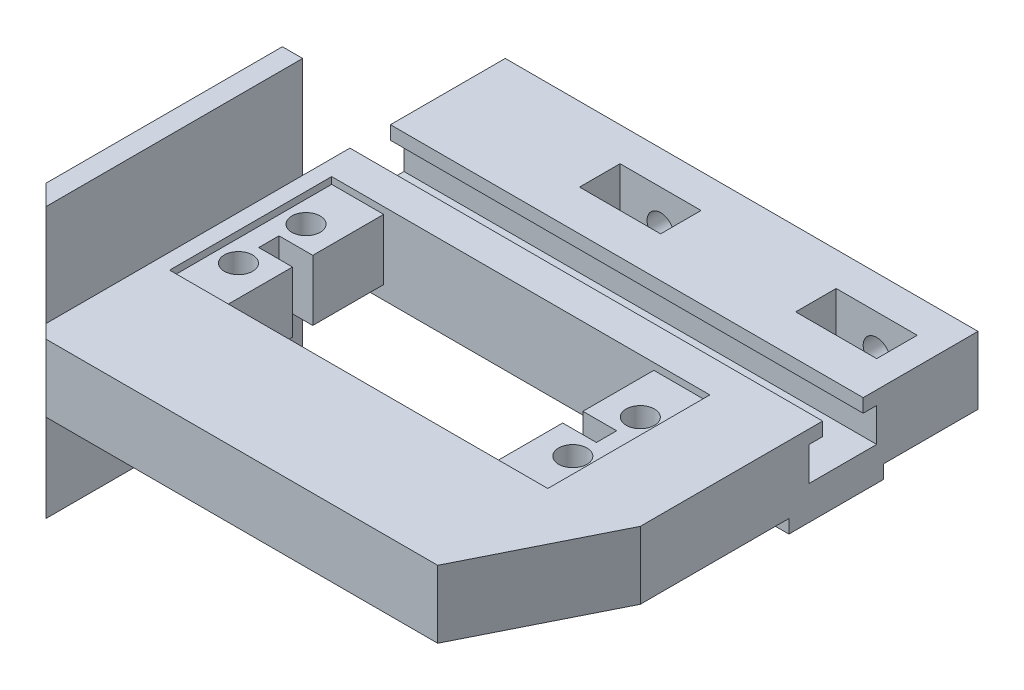
from build123d import *

# Parameters (mm, degrees)
SKETCH_1_W           = 80
SKETCH_1_H           = 60
SKETCH_1_R           = 2.1
SKETCH_1_W_2         = 40
SKETCH_1_H_2         = 24
EXTRUDE_1_DEPTH      = 10
CUT_EXTRUDE_1_DEPTH  = 80
SKETCH_5_W           = 5
SKETCH_5_H           = 3
CUT_EXTRUDE_2_DEPTH  = 80
SKETCH_7_W           = 56
SKETCH_7_H           = 24
CUT_EXTRUDE_3_DEPTH  = 1
SKETCH_8_W           = 40
SKETCH_8_H           = 40
EXTRUDE_2_DEPTH      = 3
SKETCH_9_W           = 10
SKETCH_9_H           = 60
CUT_EXTRUDE_4_DEPTH  = 10
CUT_EXTRUDE_11_DEPTH = 28
CUT_EXTRUDE_12_DEPTH = 41
SKETCH_24_W          = 10
SKETCH_24_H          = 10
EXTRUDE_3_DEPTH      = 70
SKETCH_25_W          = 12
SKETCH_25_H          = 6
CUT_EXTRUDE_13_DEPTH = 9
SKETCH_26_R          = 2
CUT_EXTRUDE_14_DEPTH = 8
CUT_EXTRUDE_15_REACH = 65.828
EXTRUDE_START        = -28
SKETCH_28_W          = 70
SKETCH_28_H          = 2
EXTRUDE_4_DEPTH      = 28
CUT_EXTRUDE_START    = -70
SKETCH_29_W          = 14
SKETCH_29_H          = 2
CUT_EXTRUDE_16_DEPTH = 70


with BuildPart() as part:
    # 草圖1 → 填料-伸長1 (new body)
    with BuildSketch(Plane(origin=(0, 0, 0), x_dir=(1, 0, 0), z_dir=(0, 1, 0))):
        Rectangle(SKETCH_1_W, SKETCH_1_H)
        with Locations(Location((-34.5, -5, 0), (0, 0, 270))):
            Circle(SKETCH_1_R, mode=Mode.SUBTRACT)
        with Locations(Location((-34.5, 5, 0), (0, 0, 270))):
            Circle(SKETCH_1_R, mode=Mode.SUBTRACT)
        with Locations(Location((15, -5, 0), (0, 0, 270))):
            Circle(SKETCH_1_R, mode=Mode.SUBTRACT)
        with Locations(Location((15, 5, 0), (0, 0, 270))):
            Circle(SKETCH_1_R, mode=Mode.SUBTRACT)
        with Locations((-10, 0)):
            Rectangle(SKETCH_1_W_2, SKETCH_1_H_2, mode=Mode.SUBTRACT)
    extrude(amount=EXTRUDE_1_DEPTH)

    # 草圖4 → 除料-伸長1 (cut)
    with BuildSketch(Plane(origin=(40, 0, 0), x_dir=(0, 0, -1), z_dir=(1, 0, 0))):
        Polygon((17, 10), (17, 8), (15, 8), (15, 3), (25, 3), (25, 8), (23, 8), (23, 10), align=None)
    extrude(amount=-CUT_EXTRUDE_1_DEPTH, mode=Mode.SUBTRACT)

    # 草圖5 → 除料-伸長2 (cut)
    with BuildSketch(Plane(origin=(0, 10, 0), x_dir=(1, 0, 0), z_dir=(0, 1, 0))):
        with Locations((12.5, 0)):
            Rectangle(SKETCH_5_W, SKETCH_5_H)
        with Locations((-32.5, 0)):
            Rectangle(SKETCH_5_W, SKETCH_5_H)
    extrude(amount=-CUT_EXTRUDE_2_DEPTH, mode=Mode.SUBTRACT)

    # 草圖7 → 除料-伸長3 (cut)
    with BuildSketch(Plane(origin=(0, 10, 0), x_dir=(1, 0, 0), z_dir=(0, 1, 0))):
        with Locations((-9.7, 0)):
            Rectangle(SKETCH_7_W, SKETCH_7_H)
    extrude(amount=-CUT_EXTRUDE_3_DEPTH, mode=Mode.SUBTRACT)

    # 草圖8 → 填料-伸長2 (add)
    with BuildSketch(Plane.ZY.offset(40)):
        with Locations((10, 5)):
            Rectangle(SKETCH_8_W, SKETCH_8_H)
    extrude(amount=EXTRUDE_2_DEPTH)

    # 草圖9 → 除料-伸長4 (cut)
    with BuildSketch(Plane(origin=(0, 10, 0), x_dir=(1, 0, 0), z_dir=(0, 1, 0))):
        with Locations((35, 0)):
            Rectangle(SKETCH_9_W, SKETCH_9_H)
    extrude(amount=-CUT_EXTRUDE_4_DEPTH, mode=Mode.SUBTRACT)

    # 草圖22 → 除料-伸長11 (cut)
    with BuildSketch(Plane(origin=(0, 10, 0), x_dir=(1, 0, 0), z_dir=(0, 1, 0))):
        Polygon((-43, -25), (-43, -30), (-38, -30), align=None)
    extrude(amount=-CUT_EXTRUDE_11_DEPTH, mode=Mode.SUBTRACT)

    # 草圖23 → 除料-伸長12 (cut)
    with BuildSketch(Plane(origin=(0, 25, 0), x_dir=(1, 0, 0), z_dir=(0, 1, 0))):
        Polygon((-43, -30), (-38, -30), (-43, -25), align=None)
    extrude(amount=-CUT_EXTRUDE_12_DEPTH, mode=Mode.SUBTRACT)

    # 草圖24 → 填料-伸長3 (add)
    with BuildSketch(Plane.ZY.offset(40)):
        with Locations((-35, 5)):
            Rectangle(SKETCH_24_W, SKETCH_24_H)
    extrude(amount=-EXTRUDE_3_DEPTH)

    # 草圖25 → 除料-伸長13 (cut)
    with BuildSketch(Plane(origin=(0, 10, 0), x_dir=(1, 0, 0), z_dir=(0, 1, 0))):
        with Locations((-12, 32)):
            Rectangle(SKETCH_25_W, SKETCH_25_H)
        with Locations((20, 32)):
            Rectangle(SKETCH_25_W, SKETCH_25_H)
    extrude(amount=-CUT_EXTRUDE_13_DEPTH, mode=Mode.SUBTRACT)

    # 草圖26 → 除料-伸長14 (cut)
    with BuildSketch(Plane(origin=(0, 0, -40), x_dir=(-1, 0, 0), z_dir=(0, 0, -1))):
        with Locations((-20, 4.723394197)):
            Circle(SKETCH_26_R)
        with Locations((12, 4.723394197)):
            Circle(SKETCH_26_R)
    extrude(amount=-CUT_EXTRUDE_14_DEPTH, mode=Mode.SUBTRACT)

    # 草圖27 → 除料-伸長15 (cut, up to next)
    with BuildSketch(Plane(origin=(0, 10, 0), x_dir=(1, 0, 0), z_dir=(0, 1, 0)), mode=Mode.PRIVATE) as cut_extrude_15_sk1:
        Polygon((30, -10), (20, -30), (30, -30), align=None)
    cut_extrude_15_tool1 = extrude(cut_extrude_15_sk1.sketch, amount=-CUT_EXTRUDE_15_REACH, mode=Mode.PRIVATE) & part.part
    add(cut_extrude_15_tool1.solids().sort_by_distance((26.666667, 10, 23.333333))[0], mode=Mode.SUBTRACT)

    # 草圖28 → 填料-伸長4 (add)
    with BuildSketch(Plane(origin=(0, 0, -40), x_dir=(-1, 0, 0), z_dir=(0, 0, -1)).offset(EXTRUDE_START)):
        with Locations((5, -1)):
            Rectangle(SKETCH_28_W, SKETCH_28_H)
    extrude(amount=EXTRUDE_4_DEPTH)

    # 草圖29 → 除料-伸長16 (cut)
    with BuildSketch(Plane(origin=(30, 0, 0), x_dir=(0, 0, -1), z_dir=(1, 0, 0)).offset(CUT_EXTRUDE_START)):
        with Locations((33, -1)):
            Rectangle(SKETCH_29_W, SKETCH_29_H)
    extrude(amount=CUT_EXTRUDE_16_DEPTH, mode=Mode.SUBTRACT)


solid = part.part
